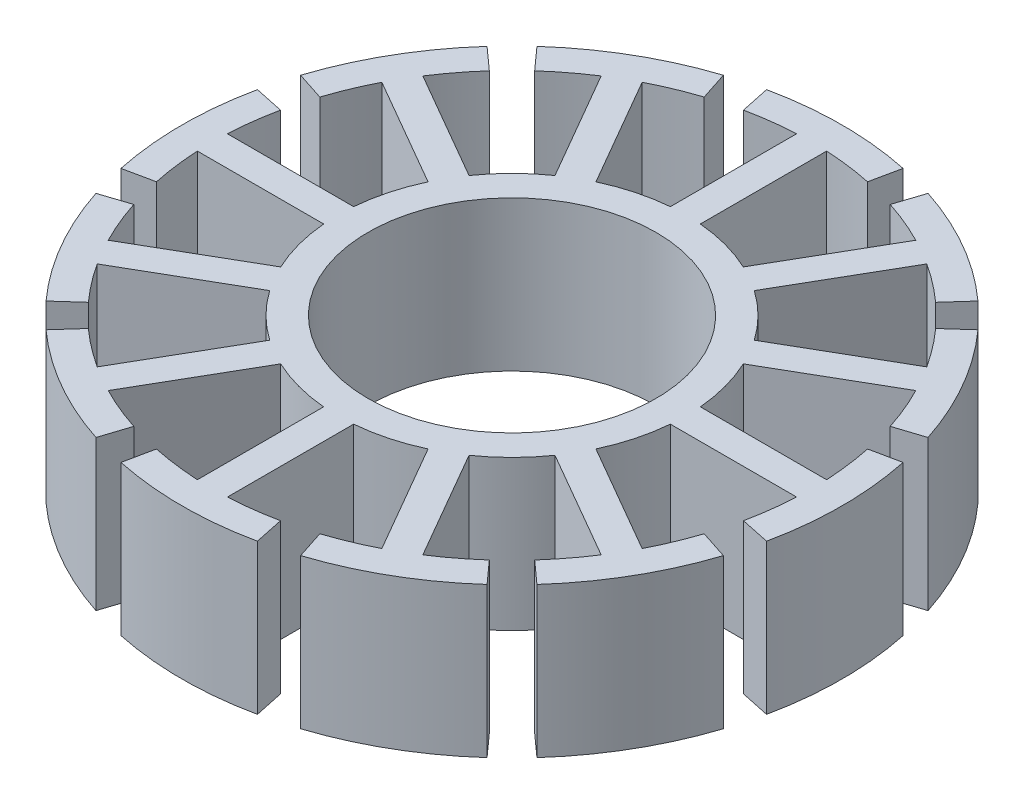
from build123d import *

# Parameters (mm, degrees)
BOSS_EXTRUDE1_DEPTH = 5


with BuildPart() as part:
    # Sketch1 → Boss-Extrude1 (new body)
    with BuildSketch(Plane(origin=(0, 0, 0), x_dir=(1, 0, 0), z_dir=(0, 1, 0))):
        with BuildLine():
            ThreePointArc((0.5, 5.778408085), (0.250232997, 5.794599507), (0, 5.8))
            Line((0, 5.8), (0, 4.8))
            ThreePointArc((0, 4.8), (3.39411255, 3.39411255), (4.8, 0))
            ThreePointArc((4.8, 0), (3.39411255, -3.39411255), (0, -4.8))
            Line((0, -4.8), (0, -5.8))
            ThreePointArc((0, -5.8), (0.250232997, -5.794599507), (0.5, -5.778408085))
            ThreePointArc((0.5, -5.778408085), (1.501150462, -5.602369792), (2.456191341, -5.254248195))
            ThreePointArc((2.456191341, -5.254248195), (2.9, -5.022947342), (3.322216745, -4.754248195))
            ThreePointArc((3.322216745, -4.754248195), (4.101219331, -4.101219331), (4.754248195, -3.322216745))
            ThreePointArc((4.754248195, -3.322216745), (5.022947342, -2.9), (5.254248195, -2.456191341))
            ThreePointArc((5.254248195, -2.456191341), (5.602369792, -1.501150462), (5.778408085, -0.5))
            ThreePointArc((5.778408085, -0.5), (5.794599507, -0.250232997), (5.8, 0))
            ThreePointArc((5.8, 0), (5.794599507, 0.250232997), (5.778408085, 0.5))
            ThreePointArc((5.778408085, 0.5), (5.602369792, 1.501150462), (5.254248195, 2.456191341))
            ThreePointArc((5.254248195, 2.456191341), (5.022947342, 2.9), (4.754248195, 3.322216745))
            ThreePointArc((4.754248195, 3.322216745), (4.101219331, 4.101219331), (3.322216745, 4.754248195))
            ThreePointArc((3.322216745, 4.754248195), (2.9, 5.022947342), (2.456191341, 5.254248195))
            ThreePointArc((2.456191341, 5.254248195), (1.501150462, 5.602369792), (0.5, 5.778408085))
        make_face()
        with BuildLine():
            Line((0, 4.8), (0, 5.8))
            ThreePointArc((0, 5.8), (-0.250232997, 5.794599507), (-0.5, 5.778408085))
            ThreePointArc((-0.5, 5.778408085), (-1.501150462, 5.602369792), (-2.456191341, 5.254248195))
            ThreePointArc((-2.456191341, 5.254248195), (-2.9, 5.022947342), (-3.322216745, 4.754248195))
            ThreePointArc((-3.322216745, 4.754248195), (-4.101219331, 4.101219331), (-4.754248195, 3.322216745))
            ThreePointArc((-4.754248195, 3.322216745), (-5.022947342, 2.9), (-5.254248195, 2.456191341))
            ThreePointArc((-5.254248195, 2.456191341), (-5.602369792, 1.501150462), (-5.778408085, 0.5))
            ThreePointArc((-5.778408085, 0.5), (-5.8, 0), (-5.778408085, -0.5))
            ThreePointArc((-5.778408085, -0.5), (-5.602369792, -1.501150462), (-5.254248195, -2.456191341))
            ThreePointArc((-5.254248195, -2.456191341), (-5.022947342, -2.9), (-4.754248195, -3.322216745))
            ThreePointArc((-4.754248195, -3.322216745), (-4.101219331, -4.101219331), (-3.322216745, -4.754248195))
            ThreePointArc((-3.322216745, -4.754248195), (-2.9, -5.022947342), (-2.456191341, -5.254248195))
            ThreePointArc((-2.456191341, -5.254248195), (-1.501150462, -5.602369792), (-0.5, -5.778408085))
            ThreePointArc((-0.5, -5.778408085), (-0.250232997, -5.794599507), (0, -5.8))
            Line((0, -5.8), (0, -4.8))
            ThreePointArc((0, -4.8), (-4.8, 0), (0, 4.8))
        make_face()
        with BuildLine():
            Line((0, 5.8), (0, 10))
            ThreePointArc((0, 10), (-0.250078211, 9.996872555), (-0.5, 9.987492178))
            Line((-0.5, 9.987492178), (-0.5, 5.778408085))
            ThreePointArc((-0.5, 5.778408085), (-0.250232997, 5.794599507), (0, 5.8))
        make_face()
        with BuildLine():
            ThreePointArc((0.5, 9.987492178), (0.250078211, 9.996872555), (0, 10))
            Line((0, 10), (0, 5.8))
            ThreePointArc((0, 5.8), (0.250232997, 5.794599507), (0.5, 5.778408085))
            Line((0.5, 5.778408085), (0.5, 9.987492178))
        make_face()
        with BuildLine():
            ThreePointArc((2.275, 10.76217334), (1.143698662, 10.940381774), (0, 11))
            Line((0, 11), (0, 10))
            ThreePointArc((0, 10), (0.250078211, 9.996872555), (0.5, 9.987492178))
            ThreePointArc((0.5, 9.987492178), (1.288123715, 9.916689836), (2.068181818, 9.783793945))
            Line((2.068181818, 9.783793945), (2.275, 10.76217334))
        make_face()
        with BuildLine():
            Line((0, 10), (0, 11))
            ThreePointArc((0, 11), (-1.143698662, 10.940381774), (-2.275, 10.76217334))
            Line((-2.275, 10.76217334), (-2.068181818, 9.783793945))
            ThreePointArc((-2.068181818, 9.783793945), (-1.288123715, 9.916689836), (-0.5, 9.987492178))
            ThreePointArc((-0.5, 9.987492178), (-0.250078211, 9.996872555), (0, 10))
        make_face()
        with BuildLine():
            Line((4.560733387, 8.899421946), (2.456191341, 5.254248195))
            ThreePointArc((2.456191341, 5.254248195), (2.9, 5.022947342), (3.322216745, 4.754248195))
            Line((3.322216745, 4.754248195), (5.426758791, 8.399421946))
            ThreePointArc((5.426758791, 8.399421946), (5, 8.660254038), (4.560733387, 8.899421946))
        make_face()
        with BuildLine():
            ThreePointArc((7.351294464, 8.182815512), (5.5, 9.526279442), (3.410878876, 10.457815512))
            Line((3.410878876, 10.457815512), (3.100798979, 9.507105011))
            ThreePointArc((3.100798979, 9.507105011), (3.842797057, 9.232167177), (4.560733387, 8.899421946))
            ThreePointArc((4.560733387, 8.899421946), (5, 8.660254038), (5.426758791, 8.399421946))
            ThreePointArc((5.426758791, 8.399421946), (6.073892778, 7.944043462), (6.682994967, 7.438923193))
            Line((6.682994967, 7.438923193), (7.351294464, 8.182815512))
        make_face()
        with BuildLine():
            Line((8.399421946, 5.426758791), (4.754248195, 3.322216745))
            ThreePointArc((4.754248195, 3.322216745), (5.022947342, 2.9), (5.254248195, 2.456191341))
            Line((5.254248195, 2.456191341), (8.899421946, 4.560733387))
            ThreePointArc((8.899421946, 4.560733387), (8.660254038, 5), (8.399421946, 5.426758791))
        make_face()
        with BuildLine():
            ThreePointArc((10.457815512, 3.410878876), (9.526279442, 5.5), (8.182815512, 7.351294464))
            Line((8.182815512, 7.351294464), (7.438923193, 6.682994967))
            ThreePointArc((7.438923193, 6.682994967), (7.944043462, 6.073892778), (8.399421946, 5.426758791))
            ThreePointArc((8.399421946, 5.426758791), (8.660254038, 5), (8.899421946, 4.560733387))
            ThreePointArc((8.899421946, 4.560733387), (9.232167177, 3.842797057), (9.507105011, 3.100798979))
            Line((9.507105011, 3.100798979), (10.457815512, 3.410878876))
        make_face()
        with BuildLine():
            Line((9.987492178, 0.5), (5.778408085, 0.5))
            ThreePointArc((5.778408085, 0.5), (5.794599507, 0.250232997), (5.8, 0))
            ThreePointArc((5.8, 0), (5.794599507, -0.250232997), (5.778408085, -0.5))
            Line((5.778408085, -0.5), (9.987492178, -0.5))
            ThreePointArc((9.987492178, -0.5), (9.996872555, -0.250078211), (10, 0))
            ThreePointArc((10, 0), (9.996872555, 0.250078211), (9.987492178, 0.5))
        make_face()
        with BuildLine():
            ThreePointArc((11, 0), (10.940381774, 1.143698662), (10.76217334, 2.275))
            Line((10.76217334, 2.275), (9.783793945, 2.068181818))
            ThreePointArc((9.783793945, 2.068181818), (9.916689836, 1.288123715), (9.987492178, 0.5))
            ThreePointArc((9.987492178, 0.5), (9.996872555, 0.250078211), (10, 0))
            ThreePointArc((10, 0), (9.996872555, -0.250078211), (9.987492178, -0.5))
            ThreePointArc((9.987492178, -0.5), (9.916689836, -1.288123715), (9.783793945, -2.068181818))
            Line((9.783793945, -2.068181818), (10.76217334, -2.275))
            ThreePointArc((10.76217334, -2.275), (10.940381774, -1.143698662), (11, 0))
        make_face()
        with BuildLine():
            ThreePointArc((5.254248195, -2.456191341), (5.022947342, -2.9), (4.754248195, -3.322216745))
            Line((4.754248195, -3.322216745), (8.399421946, -5.426758791))
            ThreePointArc((8.399421946, -5.426758791), (8.660254038, -5), (8.899421946, -4.560733387))
            Line((8.899421946, -4.560733387), (5.254248195, -2.456191341))
        make_face()
        with BuildLine():
            ThreePointArc((8.182815512, -7.351294464), (9.526279442, -5.5), (10.457815512, -3.410878876))
            Line((10.457815512, -3.410878876), (9.507105011, -3.100798979))
            ThreePointArc((9.507105011, -3.100798979), (9.232167177, -3.842797057), (8.899421946, -4.560733387))
            ThreePointArc((8.899421946, -4.560733387), (8.660254038, -5), (8.399421946, -5.426758791))
            ThreePointArc((8.399421946, -5.426758791), (7.944043462, -6.073892778), (7.438923193, -6.682994967))
            Line((7.438923193, -6.682994967), (8.182815512, -7.351294464))
        make_face()
        with BuildLine():
            ThreePointArc((3.322216745, -4.754248195), (2.9, -5.022947342), (2.456191341, -5.254248195))
            Line((2.456191341, -5.254248195), (4.560733387, -8.899421946))
            ThreePointArc((4.560733387, -8.899421946), (5, -8.660254038), (5.426758791, -8.399421946))
            Line((5.426758791, -8.399421946), (3.322216745, -4.754248195))
        make_face()
        with BuildLine():
            ThreePointArc((5.426758791, -8.399421946), (5, -8.660254038), (4.560733387, -8.899421946))
            ThreePointArc((4.560733387, -8.899421946), (3.842797057, -9.232167177), (3.100798979, -9.507105011))
            Line((3.100798979, -9.507105011), (3.410878876, -10.457815512))
            ThreePointArc((3.410878876, -10.457815512), (5.5, -9.526279442), (7.351294464, -8.182815512))
            Line((7.351294464, -8.182815512), (6.682994967, -7.438923193))
            ThreePointArc((6.682994967, -7.438923193), (6.073892778, -7.944043462), (5.426758791, -8.399421946))
        make_face()
        with BuildLine():
            Line((0, -10), (0, -5.8))
            ThreePointArc((0, -5.8), (-0.250232997, -5.794599507), (-0.5, -5.778408085))
            Line((-0.5, -5.778408085), (-0.5, -9.987492178))
            ThreePointArc((-0.5, -9.987492178), (-0.250078211, -9.996872555), (0, -10))
        make_face()
        with BuildLine():
            ThreePointArc((0.5, -5.778408085), (0.250232997, -5.794599507), (0, -5.8))
            Line((0, -5.8), (0, -10))
            ThreePointArc((0, -10), (0.250078211, -9.996872555), (0.5, -9.987492178))
            Line((0.5, -9.987492178), (0.5, -5.778408085))
        make_face()
        with BuildLine():
            ThreePointArc((0.5, -9.987492178), (0.250078211, -9.996872555), (0, -10))
            Line((0, -10), (0, -11))
            ThreePointArc((0, -11), (1.143698662, -10.940381774), (2.275, -10.76217334))
            Line((2.275, -10.76217334), (2.068181818, -9.783793945))
            ThreePointArc((2.068181818, -9.783793945), (1.288123715, -9.916689836), (0.5, -9.987492178))
        make_face()
        with BuildLine():
            Line((0, -11), (0, -10))
            ThreePointArc((0, -10), (-0.250078211, -9.996872555), (-0.5, -9.987492178))
            ThreePointArc((-0.5, -9.987492178), (-1.288123715, -9.916689836), (-2.068181818, -9.783793945))
            Line((-2.068181818, -9.783793945), (-2.275, -10.76217334))
            ThreePointArc((-2.275, -10.76217334), (-1.143698662, -10.940381774), (0, -11))
        make_face()
        with BuildLine():
            Line((-4.560733387, -8.899421946), (-2.456191341, -5.254248195))
            ThreePointArc((-2.456191341, -5.254248195), (-2.9, -5.022947342), (-3.322216745, -4.754248195))
            Line((-3.322216745, -4.754248195), (-5.426758791, -8.399421946))
            ThreePointArc((-5.426758791, -8.399421946), (-5, -8.660254038), (-4.560733387, -8.899421946))
        make_face()
        with BuildLine():
            ThreePointArc((-3.100798979, -9.507105011), (-3.842797057, -9.232167177), (-4.560733387, -8.899421946))
            ThreePointArc((-4.560733387, -8.899421946), (-5, -8.660254038), (-5.426758791, -8.399421946))
            ThreePointArc((-5.426758791, -8.399421946), (-6.073892778, -7.944043462), (-6.682994967, -7.438923193))
            Line((-6.682994967, -7.438923193), (-7.351294464, -8.182815512))
            ThreePointArc((-7.351294464, -8.182815512), (-5.5, -9.526279442), (-3.410878876, -10.457815512))
            Line((-3.410878876, -10.457815512), (-3.100798979, -9.507105011))
        make_face()
        with BuildLine():
            Line((-8.399421946, -5.426758791), (-4.754248195, -3.322216745))
            ThreePointArc((-4.754248195, -3.322216745), (-5.022947342, -2.9), (-5.254248195, -2.456191341))
            Line((-5.254248195, -2.456191341), (-8.899421946, -4.560733387))
            ThreePointArc((-8.899421946, -4.560733387), (-8.660254038, -5), (-8.399421946, -5.426758791))
        make_face()
        with BuildLine():
            Line((-9.507105011, -3.100798979), (-10.457815512, -3.410878876))
            ThreePointArc((-10.457815512, -3.410878876), (-9.526279442, -5.5), (-8.182815512, -7.351294464))
            Line((-8.182815512, -7.351294464), (-7.438923193, -6.682994967))
            ThreePointArc((-7.438923193, -6.682994967), (-7.944043462, -6.073892778), (-8.399421946, -5.426758791))
            ThreePointArc((-8.399421946, -5.426758791), (-8.660254038, -5), (-8.899421946, -4.560733387))
            ThreePointArc((-8.899421946, -4.560733387), (-9.232167177, -3.842797057), (-9.507105011, -3.100798979))
        make_face()
        with BuildLine():
            ThreePointArc((-5.778408085, -0.5), (-5.8, 0), (-5.778408085, 0.5))
            Line((-5.778408085, 0.5), (-9.987492178, 0.5))
            ThreePointArc((-9.987492178, 0.5), (-10, 0), (-9.987492178, -0.5))
            Line((-9.987492178, -0.5), (-5.778408085, -0.5))
        make_face()
        with BuildLine():
            Line((-9.783793945, 2.068181818), (-10.76217334, 2.275))
            ThreePointArc((-10.76217334, 2.275), (-11, 0), (-10.76217334, -2.275))
            Line((-10.76217334, -2.275), (-9.783793945, -2.068181818))
            ThreePointArc((-9.783793945, -2.068181818), (-9.916689836, -1.288123715), (-9.987492178, -0.5))
            ThreePointArc((-9.987492178, -0.5), (-10, 0), (-9.987492178, 0.5))
            ThreePointArc((-9.987492178, 0.5), (-9.916689836, 1.288123715), (-9.783793945, 2.068181818))
        make_face()
        with BuildLine():
            ThreePointArc((-5.254248195, 2.456191341), (-5.022947342, 2.9), (-4.754248195, 3.322216745))
            Line((-4.754248195, 3.322216745), (-8.399421946, 5.426758791))
            ThreePointArc((-8.399421946, 5.426758791), (-8.660254038, 5), (-8.899421946, 4.560733387))
            Line((-8.899421946, 4.560733387), (-5.254248195, 2.456191341))
        make_face()
        with BuildLine():
            Line((-7.438923193, 6.682994967), (-8.182815512, 7.351294464))
            ThreePointArc((-8.182815512, 7.351294464), (-9.526279442, 5.5), (-10.457815512, 3.410878876))
            Line((-10.457815512, 3.410878876), (-9.507105011, 3.100798979))
            ThreePointArc((-9.507105011, 3.100798979), (-9.232167177, 3.842797057), (-8.899421946, 4.560733387))
            ThreePointArc((-8.899421946, 4.560733387), (-8.660254038, 5), (-8.399421946, 5.426758791))
            ThreePointArc((-8.399421946, 5.426758791), (-7.944043462, 6.073892778), (-7.438923193, 6.682994967))
        make_face()
        with BuildLine():
            ThreePointArc((-3.322216745, 4.754248195), (-2.9, 5.022947342), (-2.456191341, 5.254248195))
            Line((-2.456191341, 5.254248195), (-4.560733387, 8.899421946))
            ThreePointArc((-4.560733387, 8.899421946), (-5, 8.660254038), (-5.426758791, 8.399421946))
            Line((-5.426758791, 8.399421946), (-3.322216745, 4.754248195))
        make_face()
        with BuildLine():
            Line((-3.100798979, 9.507105011), (-3.410878876, 10.457815512))
            ThreePointArc((-3.410878876, 10.457815512), (-5.5, 9.526279442), (-7.351294464, 8.182815512))
            Line((-7.351294464, 8.182815512), (-6.682994967, 7.438923193))
            ThreePointArc((-6.682994967, 7.438923193), (-6.073892778, 7.944043462), (-5.426758791, 8.399421946))
            ThreePointArc((-5.426758791, 8.399421946), (-5, 8.660254038), (-4.560733387, 8.899421946))
            ThreePointArc((-4.560733387, 8.899421946), (-3.842797057, 9.232167177), (-3.100798979, 9.507105011))
        make_face()
    extrude(amount=BOSS_EXTRUDE1_DEPTH)


solid = part.part
